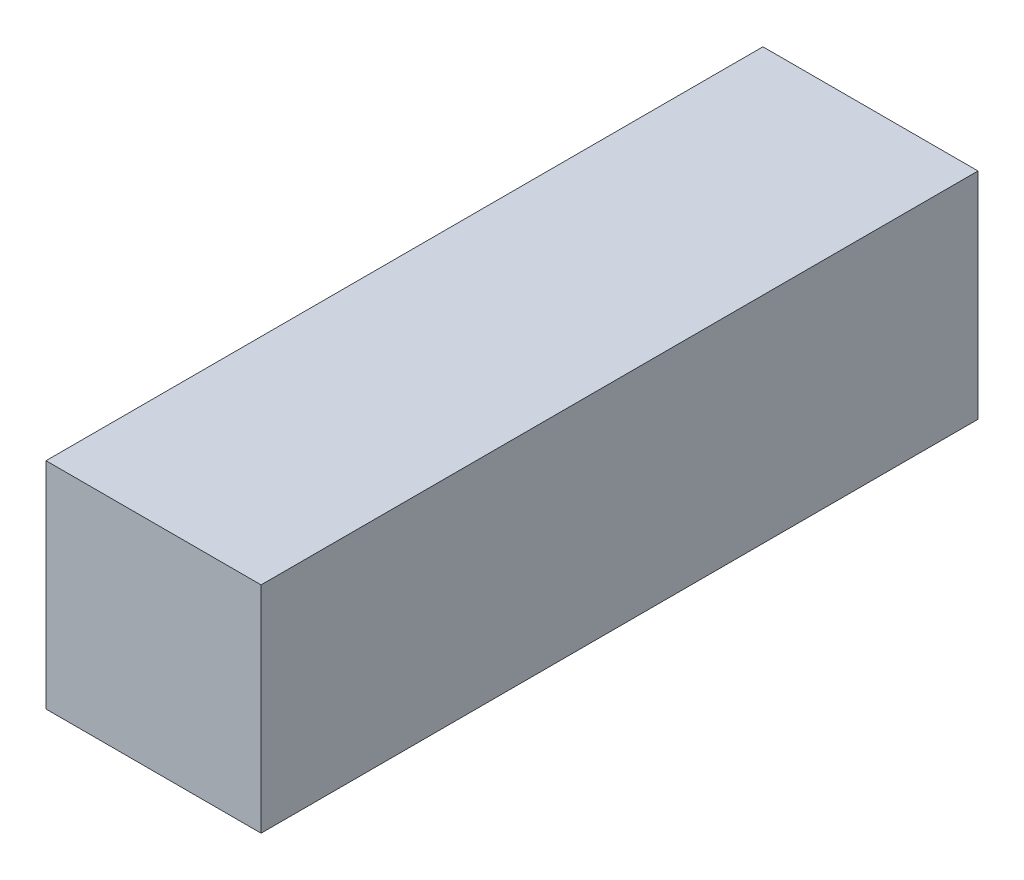
from build123d import *

# Parameters (mm, degrees)
SKETCH1_W           = 6
SKETCH1_H           = 6
BOSS_EXTRUDE1_DEPTH = 20


with BuildPart() as part:
    # Sketch1 → Boss-Extrude1 (new body)
    with BuildSketch(Plane.XY):
        with Locations((0, 10.4)):
            Rectangle(SKETCH1_W, SKETCH1_H)
    extrude(amount=BOSS_EXTRUDE1_DEPTH)


solid = part.part
